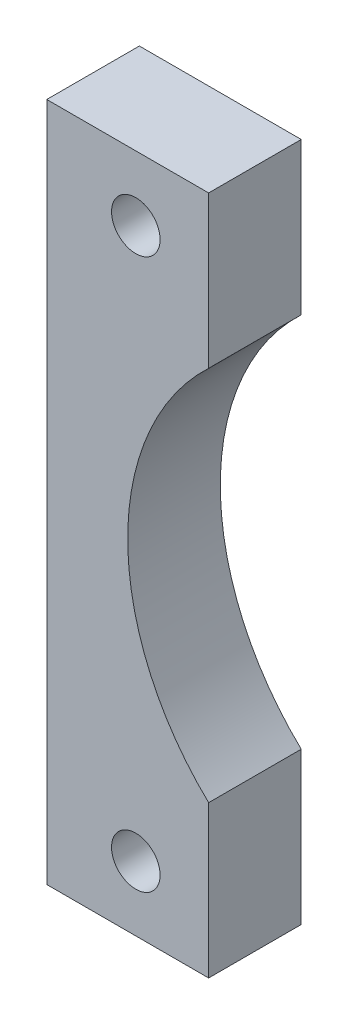
from build123d import *

# Parameters (mm, degrees)
SKETCH1_R           = 1.5
BOSS_EXTRUDE1_DEPTH = 5.72


with BuildPart() as part:
    # Sketch1 → Boss-Extrude1 (new body)
    with BuildSketch(Plane.XY):
        with BuildLine():
            Line((0, 0), (10, 0))
            Line((10, 0), (10, -9.381049961))
            ThreePointArc((10, -9.381049961), (5, -21), (10, -32.618950039))
            Line((10, -32.618950039), (10, -42))
            Line((10, -42), (0, -42))
            Line((0, -42), (0, 0))
        make_face()
        with Locations((5.5, -38)):
            Circle(SKETCH1_R, mode=Mode.SUBTRACT)
        with Locations((5.5, -4)):
            Circle(SKETCH1_R, mode=Mode.SUBTRACT)
    extrude(amount=BOSS_EXTRUDE1_DEPTH)


solid = part.part
